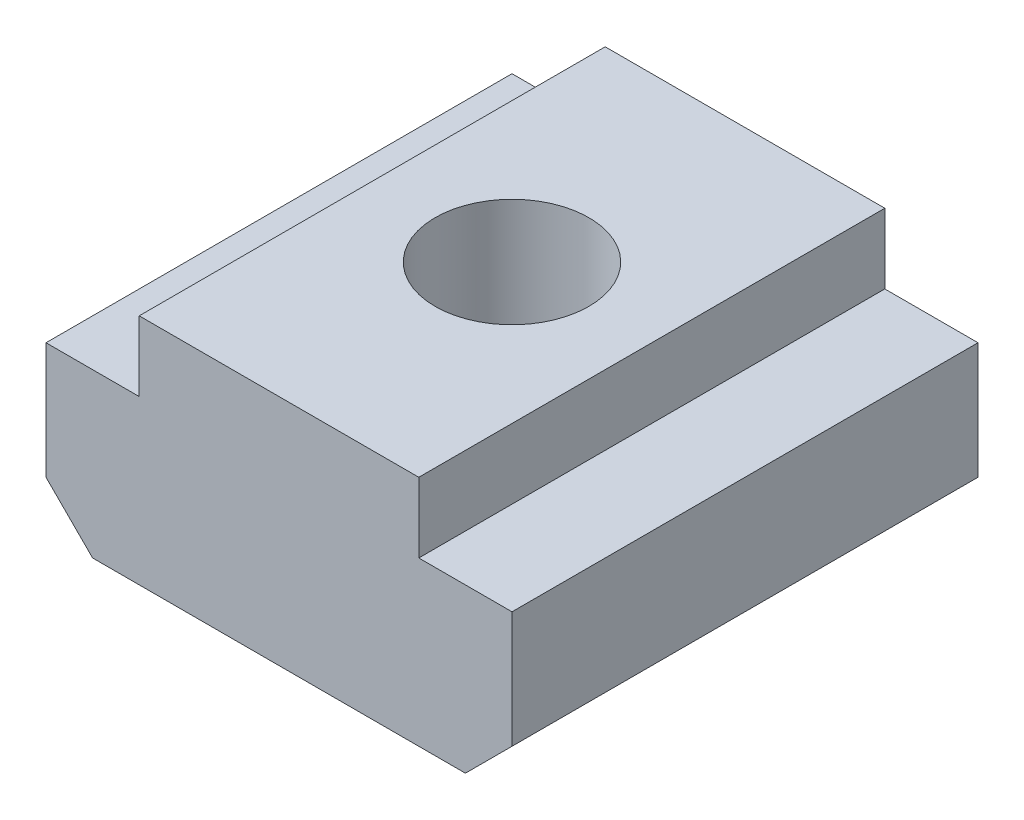
from build123d import *

# Parameters (mm, degrees)
BOSS_EXTRUDE1_DEPTH   = 10
M4X0_7_TAPPED_HOLE1_D = 3.3


with BuildPart() as part:
    # Sketch1 → Boss-Extrude1 (new body)
    with BuildSketch(Plane.XY):
        Polygon((-4, 0), (4, 0), (5, 1), (5, 3.5), (3, 3.5), (3, 5), (-3, 5), (-3, 3.5), (-5, 3.5), (-5, 1), align=None)
    extrude(amount=BOSS_EXTRUDE1_DEPTH)

    # M4x0.7 Tapped Hole1 (through all)
    with Locations(Plane(origin=(0, 5, 0), x_dir=(1, 0, 0), z_dir=(0, 1, 0))):
        with Locations((0, -5)):
            Hole(M4X0_7_TAPPED_HOLE1_D / 2)


solid = part.part
